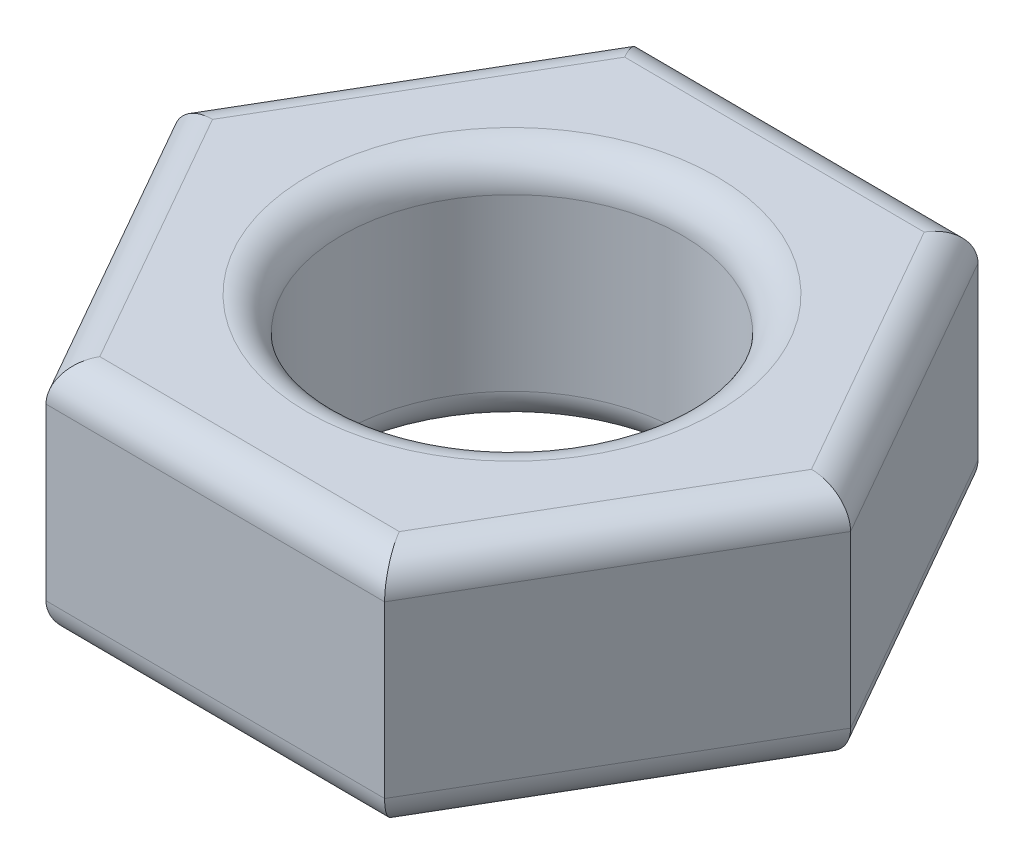
from build123d import *

# Parameters (mm, degrees)
SKETCH1_W                        = 20
SKETCH1_H                        = 20
BOSS_EXTRUDE1_DEPTH              = 7
F_10_0MM_CLEARANCE_DOWEL_HOLE1_D = 10
CUT_EXTRUDE1_DEPTH               = 16.779733838
FILLET1_R                        = 1


with BuildPart() as part:
    # Sketch1 → Boss-Extrude1 (new body)
    with BuildSketch(Plane(origin=(0, 0, 0), x_dir=(1, 0, 0), z_dir=(0, 1, 0))):
        Rectangle(SKETCH1_W, SKETCH1_H)
    extrude(amount=BOSS_EXTRUDE1_DEPTH)

    # Ø10.0mm Clearance Dowel Hole1 (through all)
    with Locations(Plane(origin=(0, 7, 0), x_dir=(1, 0, 0), z_dir=(0, 1, 0))):
        with Locations((0, 0)):
            Hole(F_10_0MM_CLEARANCE_DOWEL_HOLE1_D / 2)

    # Sketch6 → Cut-Extrude1 (cut, through all)
    with BuildSketch(Plane(origin=(0, 7, 0), x_dir=(1, 0, 0), z_dir=(0, 1, 0))):
        Polygon((-10, 10), (-10, 0.058741053), (-4.949128756, 8.689624564), (5.050871244, 8.630883511), (10, -0.058741053), (10, 10), align=None)
        Polygon((4.949128756, -8.689624564), (-5.050871244, -8.630883511), (-10, 0.058741053), (-10, -10), (10, -10), (10, -0.058741053), align=None)
    extrude(amount=-CUT_EXTRUDE1_DEPTH, mode=Mode.SUBTRACT)

    # Fillet1
    fillet1_edges = [part.edges().sort_by_distance(p)[0] for p in [
        (5, 7, 0),
        (5, 0, 0),
        (-7.474564378, 7, -4.374182809),
        (7.525435622, 7, -4.286071229),
        (0.050871244, 7, -8.660254038),
        (-7.474564378, 0, -4.374182809),
        (7.525435622, 0, -4.286071229),
        (0.050871244, 0, -8.660254038),
        (-7.525435622, 7, 4.286071229),
        (-0.050871244, 7, 8.660254038),
        (7.474564378, 7, 4.374182809),
        (-7.525435622, 0, 4.286071229),
        (-0.050871244, 0, 8.660254038),
        (7.474564378, 0, 4.374182809),
    ]]
    fillet(fillet1_edges, radius=FILLET1_R)


solid = part.part
